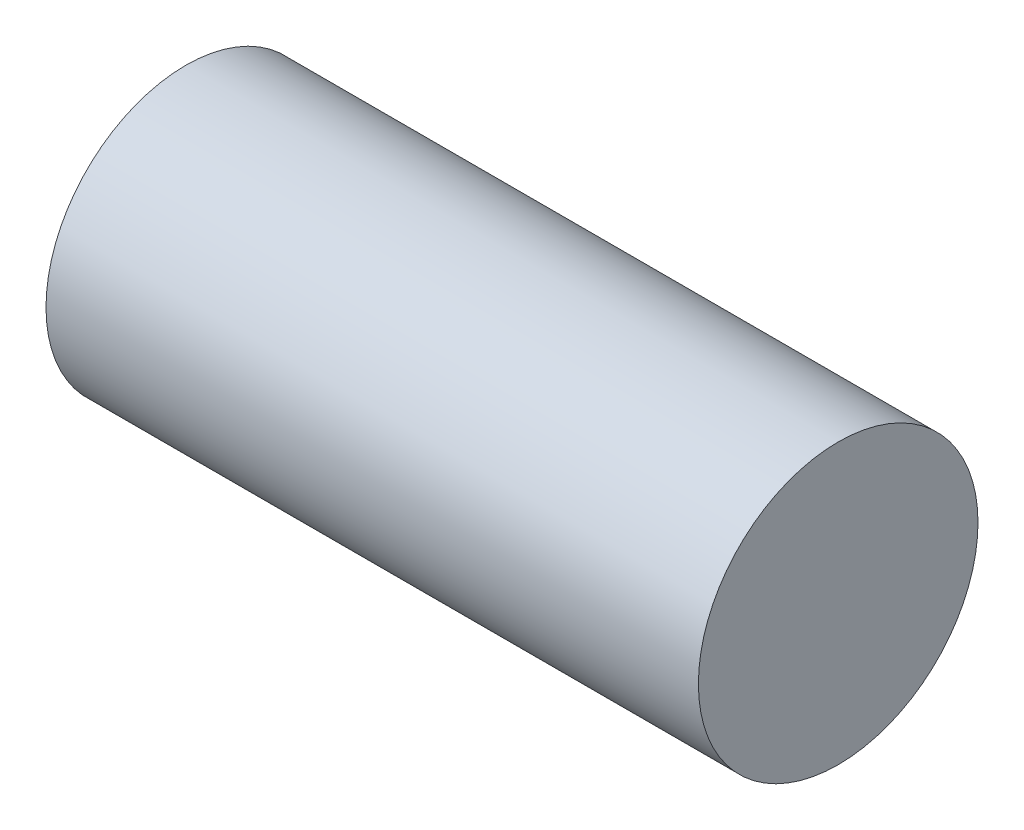
from build123d import *

# Parameters (mm, degrees)
SKETCH_1_R      = 1.5
EXTRUDE_1_DEPTH = 7


with BuildPart() as part:
    # 草图1 → 凸台-拉伸1 (new body)
    with BuildSketch(Plane(origin=(0, 0, 0), x_dir=(0, 0, -1), z_dir=(1, 0, 0))):
        Circle(SKETCH_1_R)
    extrude(amount=EXTRUDE_1_DEPTH)


solid = part.part
